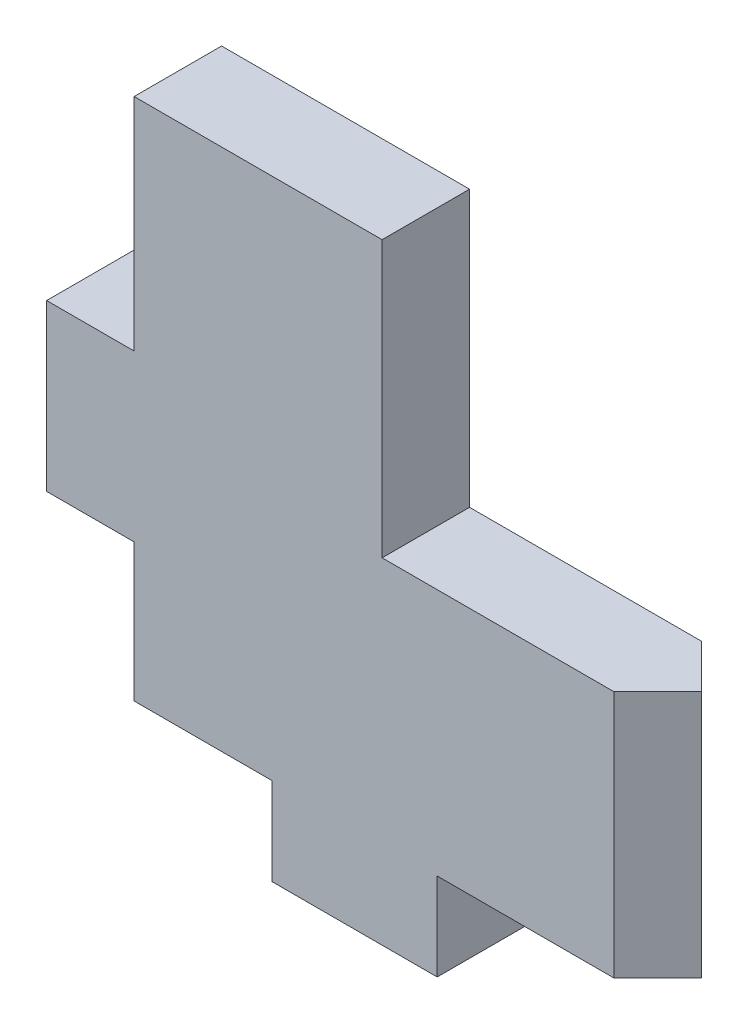
from build123d import *

# Parameters (mm, degrees)
BOSS_EXTRUDE1_DEPTH = 1.5875
CUT_EXTRUDE3_DEPTH  = 10


with BuildPart() as part:
    # Sketch1 → Boss-Extrude1 (new, symmetric)
    with BuildSketch(Plane.XY):
        Polygon((0, 0), (5, 0), (5, -3.175), (11, -3.175), (11, 0), (19, 0), (19, 9), (9, 9), (9, 19), (0, 19), (0, 11), (-3.175, 11), (-3.175, 5), (0, 5), align=None)
    extrude(amount=BOSS_EXTRUDE1_DEPTH, both=True)

    # Sketch2 → Cut-Extrude3 (cut, symmetric)
    with BuildSketch(Plane(origin=(0, 9, 0), x_dir=(1, 0, 0), z_dir=(0, 1, 0))):
        Polygon((19, 0), (17.4125, -1.5875), (19.19836718, -4.188524989), (21.145490005, 0), (20.434145586, 3.927655586), (17.4125, 1.5875), align=None)
    extrude(amount=CUT_EXTRUDE3_DEPTH, both=True, mode=Mode.SUBTRACT)


solid = part.part
